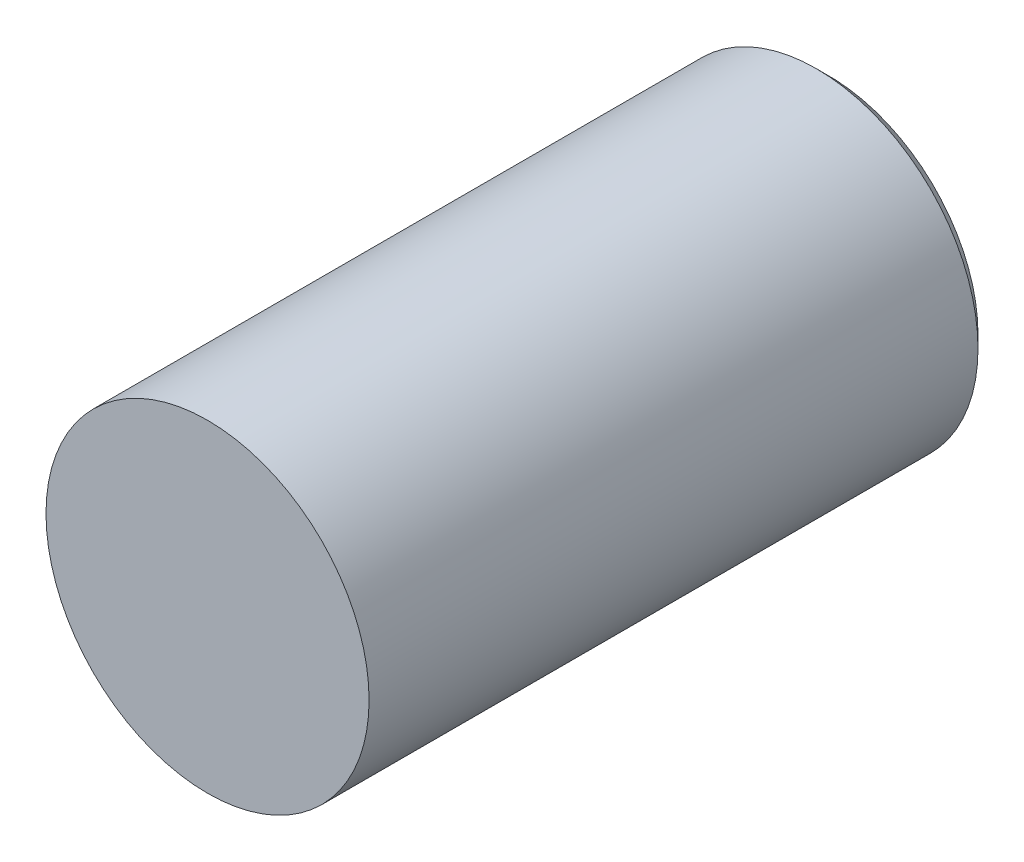
from build123d import *

# Parameters (mm, degrees)
SKETCH_1_R      = 3.9
SKETCH_1_R_2    = 2.6
EXTRUDE_1_DEPTH = 15
EXTRUDE_START   = -7
SKETCH_2_R      = 2.6
EXTRUDE_2_DEPTH = 7
EXTRUDE_START_2 = 6.2
EXTRUDE_3_DEPTH = 6.2
CHAMFER_1_SIZE  = 0.3
CHAMFER_2_SIZE  = 0.3
CHAMFER_3_SIZE  = 0.3


with BuildPart() as part:
    # 草图1 → 凸台-拉伸1 (new body)
    with BuildSketch(Plane.XY):
        Circle(SKETCH_1_R)
        Circle(SKETCH_1_R_2, mode=Mode.SUBTRACT)
    extrude(amount=EXTRUDE_1_DEPTH)

    # 草图2 → 凸台-拉伸2 (add)
    with BuildSketch(Plane.XY.offset(15).offset(EXTRUDE_START)):
        Circle(SKETCH_2_R)
    extrude(amount=EXTRUDE_2_DEPTH)

    # 草图3 → 凸台-拉伸3 (add)
    with BuildSketch(Plane(origin=(0, 0, 8), x_dir=(-1, 0, 0), z_dir=(0, 0, -1)).offset(EXTRUDE_START_2)):
        with BuildLine():
            Line((-1.6, -2.049390153), (-1.6, 2.049390153))
            ThreePointArc((-1.6, 2.049390153), (-2.6, 0), (-1.6, -2.049390153))
        make_face()
        with BuildLine():
            ThreePointArc((2.6, 0), (2.336664289, 1.140175425), (1.6, 2.049390153))
            Line((1.6, 2.049390153), (1.6, -2.049390153))
            ThreePointArc((1.6, -2.049390153), (2.336664289, -1.140175425), (2.6, 0))
        make_face()
    extrude(amount=-EXTRUDE_3_DEPTH)

    # 倒角1
    chamfer_1_edges = [part.edges().sort_by_distance(p)[0] for p in [
        (-2.6, 0, 0),
    ]]
    chamfer(chamfer_1_edges, length=CHAMFER_1_SIZE)

    # 倒角2
    chamfer_2_edges = [part.edges().sort_by_distance(p)[0] for p in [
        (-3.9, 0, 0),
    ]]
    chamfer(chamfer_2_edges, length=CHAMFER_2_SIZE)

    # 倒角3
    chamfer_3_edges = [part.edges().sort_by_distance(p)[0] for p in [
        (1.6, 0, 1.8),
        (-1.6, 0, 1.8),
    ]]
    chamfer(chamfer_3_edges, length=CHAMFER_3_SIZE)


solid = part.part
